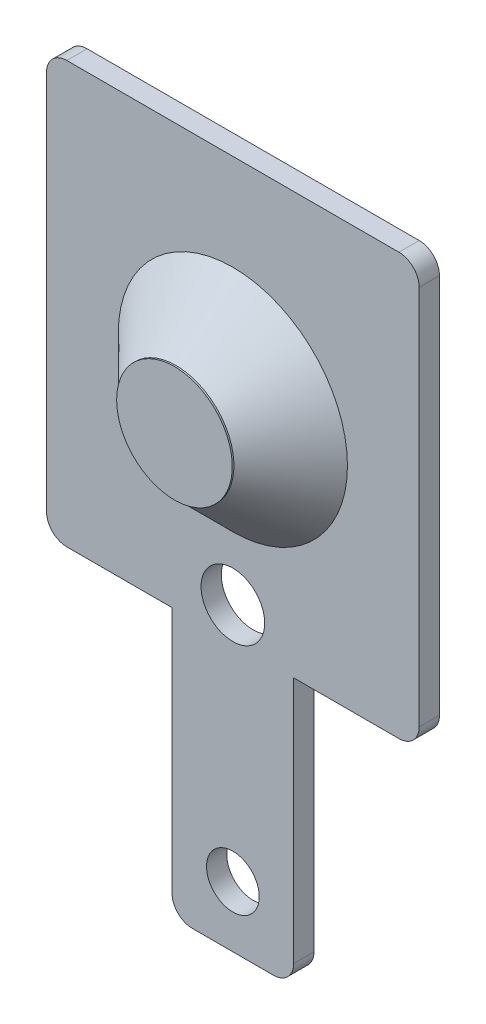
from build123d import *

# Parameters (mm, degrees)
SKETCH1_R           = 0.65
SKETCH1_R_2         = 0.785
BOSS_EXTRUDE1_DEPTH = 0.5
FILLET1_R           = 0.5
SKETCH6_R           = 1.426206797
BOSS_EXTRUDE3_DEPTH = 1.44
CHAMFER1_SIZE       = 1.4


with BuildPart() as part:
    # Sketch1 → Boss-Extrude1 (new body)
    with BuildSketch(Plane.XY):
        Polygon((0, 0), (9.19, 0), (9.19, -10.3886), (6.095, -10.3886), (6.095, -16.99), (3.095, -16.99), (3.095, -10.3886), (0, -10.3886), align=None)
        with Locations((4.595, -15.49)):
            Circle(SKETCH1_R, mode=Mode.SUBTRACT)
        with Locations((4.595, -9.5786)):
            Circle(SKETCH1_R_2, mode=Mode.SUBTRACT)
    extrude(amount=BOSS_EXTRUDE1_DEPTH)

    # Fillet1
    fillet1_edges = [part.edges().sort_by_distance(p)[0] for p in [
        (9.19, -10.3886, 0.25),
        (0, 0, 0.25),
        (9.19, 0, 0.25),
        (6.095, -16.99, 0.25),
        (3.095, -16.99, 0.25),
        (0, -10.3886, 0.25),
    ]]
    fillet(fillet1_edges, radius=FILLET1_R)

    # Sketch6 → Boss-Extrude3 (add)
    with BuildSketch(Plane.XY.offset(0.5)):
        with Locations((4.595, -5.1943)):
            Circle(SKETCH6_R)
    extrude(amount=BOSS_EXTRUDE3_DEPTH)

    # Chamfer1
    chamfer1_edges = [part.edges().sort_by_distance(p)[0] for p in [
        (3.168793203, -5.1943, 0.5),
    ]]
    chamfer(chamfer1_edges, length=CHAMFER1_SIZE)


solid = part.part
